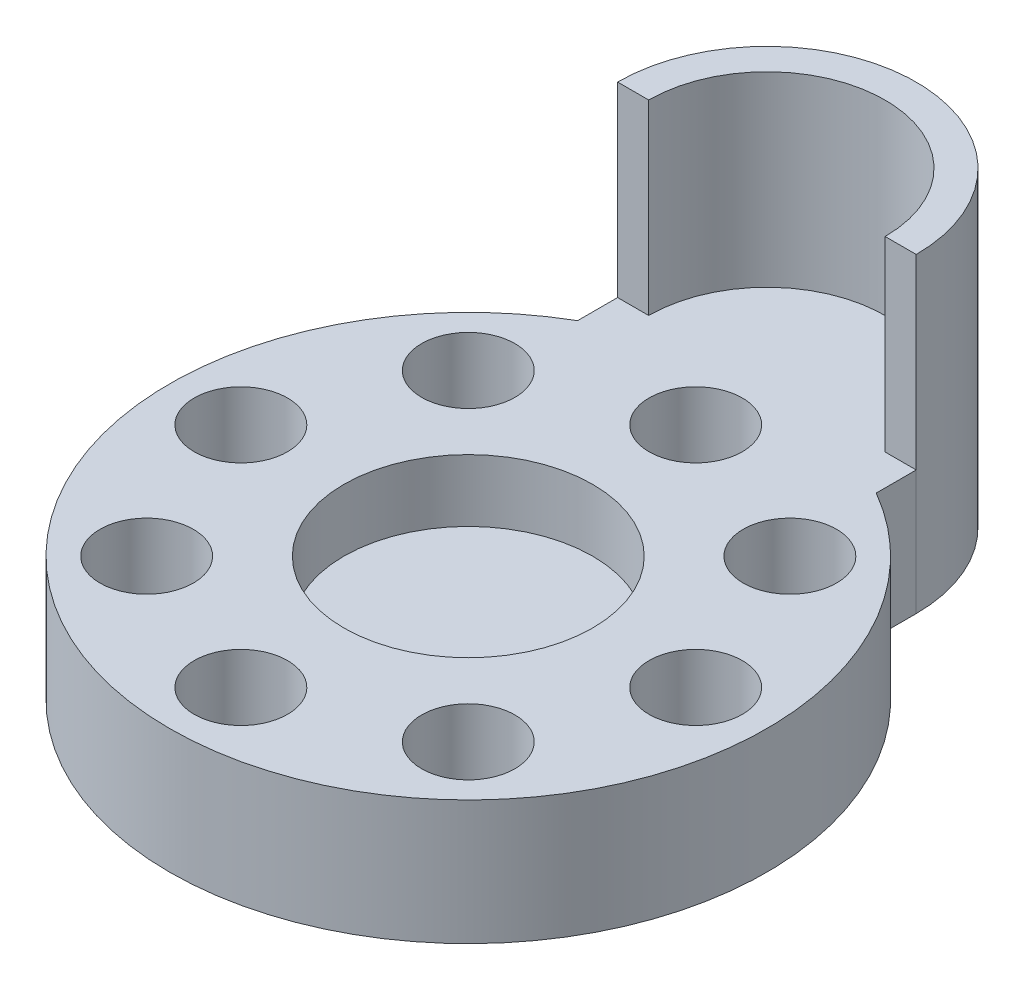
from build123d import *

# Parameters (mm, degrees)
EXTRUDE_1_DEPTH     = 20
SKETCH_2_R          = 20
CUT_EXTRUDE_1_DEPTH = 10
SKETCH_3_R          = 7.5
CUT_EXTRUDE_2_DEPTH = 89.814413245
EXTRUDE_2_DEPTH     = 30


with BuildPart() as part:
    # 草圖1 → 填料-伸長1 (new body)
    with BuildSketch(Plane(origin=(0, 0, 0), x_dir=(1, 0, 0), z_dir=(0, 1, 0))):
        with BuildLine():
            Line((-24, 41.569219382), (-24, 48))
            ThreePointArc((-24, 48), (0, 72), (24, 48))
            Line((24, 48), (24, 41.569219382))
            ThreePointArc((24, 41.569219382), (0, -48), (-24, 41.569219382))
        make_face()
    extrude(amount=EXTRUDE_1_DEPTH)

    # 草圖2 → 除料-伸長1 (cut)
    with BuildSketch(Plane(origin=(0, 20, 0), x_dir=(1, 0, 0), z_dir=(0, 1, 0))):
        with Locations(Location((0, 0, 0), (0, 0, 270))):
            Circle(SKETCH_2_R)
    extrude(amount=-CUT_EXTRUDE_1_DEPTH, mode=Mode.SUBTRACT)

    # 草圖3 → 除料-伸長2 (cut, through all)
    with BuildSketch(Plane(origin=(0, 20, 0), x_dir=(1, 0, 0), z_dir=(0, 1, 0))):
        with Locations(Location((0, 36.553135894, 0), (0, 0, 270))):
            Circle(SKETCH_3_R)
        with Locations(Location((25.846970264, 25.846970264, 0), (0, 0, 270))):
            Circle(SKETCH_3_R)
        with Locations(Location((36.553135894, 0, 0), (0, 0, 270))):
            Circle(SKETCH_3_R)
        with Locations(Location((25.846970264, -25.846970264, 0), (0, 0, 270))):
            Circle(SKETCH_3_R)
        with Locations(Location((0, -36.553135894, 0), (0, 0, 270))):
            Circle(SKETCH_3_R)
        with Locations(Location((-25.846970264, -25.846970264, 0), (0, 0, 270))):
            Circle(SKETCH_3_R)
        with Locations(Location((-36.553135894, 0, 0), (0, 0, 270))):
            Circle(SKETCH_3_R)
        with Locations(Location((-25.846970264, 25.846970264, 0), (0, 0, 270))):
            Circle(SKETCH_3_R)
    extrude(amount=-CUT_EXTRUDE_2_DEPTH, mode=Mode.SUBTRACT)

    # 草圖4 → 填料-伸長2 (add)
    with BuildSketch(Plane(origin=(0, 20, 0), x_dir=(1, 0, 0), z_dir=(0, 1, 0))):
        with BuildLine():
            Line((-24, 48), (-19, 48))
            ThreePointArc((-19, 48), (0, 67), (19, 48))
            Line((19, 48), (24, 48))
            ThreePointArc((24, 48), (0, 72), (-24, 48))
        make_face()
    extrude(amount=EXTRUDE_2_DEPTH)


solid = part.part
